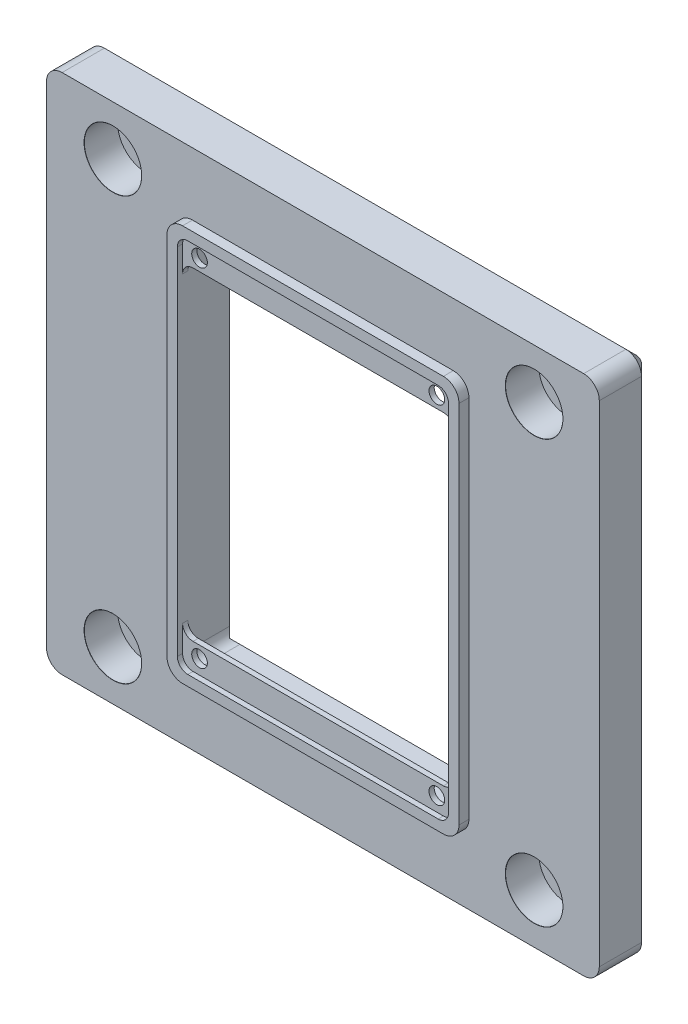
from build123d import *

# Parameters (mm, degrees)
BOSS_EXTRUDE3_DEPTH                          = 10
BOSS_EXTRUDE3_DEPTH_BACK                     = 0.1
SKETCH1_W                                    = 100
SKETCH1_H                                    = 106
SKETCH1_W_2                                  = 76
SKETCH1_H_2                                  = 56
CBORE_FOR_M6_HEX_SOCKET_HEAD_CAP_SCR_2_COUNT = 2
CBORE_FOR_M6_HEX_SOCKET_HEAD_CAP_SCR_2_PITCH = 81
CBORE_FOR_M6_HEX_SOCKET_HEAD_CAP_SCR_3_COUNT = 2
CBORE_FOR_M6_HEX_SOCKET_HEAD_CAP_SCR_3_PITCH = 114.385386776
CBORE_FOR_M6_HEX_SOCKET_HEAD_CAP_SCR_4_COUNT = 2
CBORE_FOR_M6_HEX_SOCKET_HEAD_CAP_SCR_4_PITCH = 80.765194904
SKETCH7_W                                    = 56
SKETCH7_H                                    = 76
BOSS_EXTRUDE4_DEPTH                          = 12
SKETCH8_W                                    = 52
SKETCH8_H                                    = 72
BOSS_EXTRUDE5_DEPTH                          = 1
SKETCH9_W                                    = 52
SKETCH9_H                                    = 72
CUT_EXTRUDE1_DEPTH                           = 1
SKETCH10_W                                   = 52
SKETCH10_H                                   = 62.005454301
CUT_EXTRUDE2_DEPTH                           = 11
SKETCH11_W                                   = 52
SKETCH11_H                                   = 4.999168043
SKETCH11_H_2                                 = 4.995377656
CUT_EXTRUDE3_DEPTH                           = 10
SKETCH12_R                                   = 1.5
CUT_EXTRUDE4_DEPTH                           = 2
SKETCH12_3_R                                 = 1.5
CUT_EXTRUDE5_DEPTH                           = 2
SKETCH14_R                                   = 1.5
CUT_EXTRUDE6_DEPTH                           = 2
SKETCH15_R                                   = 1.5
CUT_EXTRUDE7_DEPTH                           = 2
FILLET2_R                                    = 3
CHAMFER1_SIZE                                = 2
FILLET3_R                                    = 2
FILLET4_R                                    = 2


with BuildPart() as part:
    # Sketch1 → Boss-Extrude3 (new, two sides: drawn at the far end of the back side and taken through both)
    with BuildSketch(Plane(origin=(0, 0, 0), x_dir=(0, 1, 0), z_dir=(0, 0, 1)).offset(-BOSS_EXTRUDE3_DEPTH_BACK)):
        with Locations((-4.589836902, -8.848323211)):
            Rectangle(SKETCH1_W, SKETCH1_H)
        with Locations((-4.589836902, -8.848323211)):
            Rectangle(SKETCH1_W_2, SKETCH1_H_2, mode=Mode.SUBTRACT)
    extrude(amount=BOSS_EXTRUDE3_DEPTH + BOSS_EXTRUDE3_DEPTH_BACK)

    # Sketch6 → CBORE for M6 Hex Socket Head Cap Screw2 (revolve, cut)
    with BuildSketch(Plane(origin=(49.348323211, -45.089836902, 10), x_dir=(0, -1, 0), z_dir=(1, 0, 0))):
        Polygon((0, 0), (0, 10.1), (3.3, 10.1), (3.3, 6.4), (5.5, 6.4), (5.5, 0.025), (5.525, 0), align=None)
    cbore_for_m6_hex_socket_head_cap_screw2 = revolve(axis=Axis((49.348323211, -45.089836902, 16.35), (0, 0, -1)), mode=Mode.SUBTRACT)

    # CBORE for M6 Hex Socket Head Cap Scr 2: CBORE for M6 Hex Socket Head Cap Screw2 ×2
    with Locations(*[(0, i * CBORE_FOR_M6_HEX_SOCKET_HEAD_CAP_SCR_2_PITCH, 0) for i in range(1, CBORE_FOR_M6_HEX_SOCKET_HEAD_CAP_SCR_2_COUNT)]):
        add(cbore_for_m6_hex_socket_head_cap_screw2, mode=Mode.SUBTRACT)

    # CBORE for M6 Hex Socket Head Cap Scr 3: CBORE for M6 Hex Socket Head Cap Screw2 ×2
    with Locations(*[Vector(-0.7060796591298035, 0.7081324134391396, 0) * (i * CBORE_FOR_M6_HEX_SOCKET_HEAD_CAP_SCR_3_PITCH) for i in range(1, CBORE_FOR_M6_HEX_SOCKET_HEAD_CAP_SCR_3_COUNT)]):
        add(cbore_for_m6_hex_socket_head_cap_screw2, mode=Mode.SUBTRACT)

    # CBORE for M6 Hex Socket Head Cap Scr 4: CBORE for M6 Hex Socket Head Cap Screw2 ×2
    with Locations(*[(-i * CBORE_FOR_M6_HEX_SOCKET_HEAD_CAP_SCR_4_PITCH, 0, 0) for i in range(1, CBORE_FOR_M6_HEX_SOCKET_HEAD_CAP_SCR_4_COUNT)]):
        add(cbore_for_m6_hex_socket_head_cap_screw2, mode=Mode.SUBTRACT)

    # Sketch7 → Boss-Extrude4 (add)
    with BuildSketch(Plane(origin=(0, 0, -0.1), x_dir=(1, 0, 0), z_dir=(0, 0, -1))):
        with Locations((8.848323211, 4.589836902)):
            Rectangle(SKETCH7_W, SKETCH7_H)
    extrude(amount=-BOSS_EXTRUDE4_DEPTH)

    # Sketch8 → Boss-Extrude5 (add)
    with BuildSketch(Plane.XY.offset(11.9)):
        with Locations((8.848323211, -4.589836902)):
            Rectangle(SKETCH8_W, SKETCH8_H)
    extrude(amount=-BOSS_EXTRUDE5_DEPTH)

    # Sketch9 → Cut-Extrude1 (cut)
    with BuildSketch(Plane.XY.offset(11.9)):
        with Locations((8.848323211, -4.589836902)):
            Rectangle(SKETCH9_W, SKETCH9_H)
    extrude(amount=-CUT_EXTRUDE1_DEPTH, mode=Mode.SUBTRACT)

    # Sketch10 → Cut-Extrude2 (cut)
    with BuildSketch(Plane.XY.offset(10.9)):
        with Locations((8.848323211, -4.587941709)):
            Rectangle(SKETCH10_W, SKETCH10_H)
    extrude(amount=-CUT_EXTRUDE2_DEPTH, mode=Mode.SUBTRACT)

    # Sketch11 → Cut-Extrude3 (cut)
    with BuildSketch(Plane(origin=(0, 0, -0.1), x_dir=(1, 0, 0), z_dir=(0, 0, -1))):
        with Locations((8.848323211, 38.090252881)):
            Rectangle(SKETCH11_W, SKETCH11_H)
        with Locations((8.848323211, -28.91247427)):
            Rectangle(SKETCH11_W, SKETCH11_H_2)
    extrude(amount=-CUT_EXTRUDE3_DEPTH, mode=Mode.SUBTRACT)

    # Sketch12 → Cut-Extrude4 (cut)
    with BuildSketch(Plane.XY.offset(10.9)):
        with Locations((-13.901676789, 28.660163098)):
            Circle(SKETCH12_R)
    extrude(amount=-CUT_EXTRUDE4_DEPTH, mode=Mode.SUBTRACT)

    # Sketch12<3> → Cut-Extrude5 (cut)
    with BuildSketch(Plane.XY.offset(10.9)):
        with Locations((31.598323211, 28.660163098)):
            Circle(SKETCH12_3_R)
    extrude(amount=-CUT_EXTRUDE5_DEPTH, mode=Mode.SUBTRACT)

    # Sketch14 → Cut-Extrude6 (cut)
    with BuildSketch(Plane.XY.offset(10.9)):
        with Locations((-13.901676789, -37.839836902)):
            Circle(SKETCH14_R)
    extrude(amount=-CUT_EXTRUDE6_DEPTH, mode=Mode.SUBTRACT)

    # Sketch15 → Cut-Extrude7 (cut)
    with BuildSketch(Plane.XY.offset(10.9)):
        with Locations((31.598323211, -37.839836902)):
            Circle(SKETCH15_R)
    extrude(amount=-CUT_EXTRUDE7_DEPTH, mode=Mode.SUBTRACT)

    # Fillet2
    fillet2_edges = [part.edges().sort_by_distance(p)[0] for p in [
        (-44.151676789, 45.410163098, 4.95),
        (-19.151676789, 33.410163098, 10.95),
        (36.848323211, 33.410163098, 10.95),
        (61.848323211, 45.410163098, 4.95),
        (36.848323211, -42.589836902, 10.95),
        (61.848323211, -54.589836902, 4.95),
        (-44.151676789, -54.589836902, 4.95),
        (-19.151676789, -42.589836902, 10.95),
    ]]
    fillet(fillet2_edges, radius=FILLET2_R)

    # Chamfer1
    chamfer1_edges = [part.edges().sort_by_distance(p)[0] for p in [
        (8.848323211, 31.410163098, -0.1),
        (34.848323211, -4.589836902, -0.1),
        (8.848323211, -40.589836902, -0.1),
        (-17.151676789, -4.589836902, -0.1),
        (49.348323211, 39.210163098, -0.1),
        (-31.416871693, 39.210163098, -0.1),
        (-31.416871693, -41.789836902, -0.1),
        (49.348323211, -41.789836902, -0.1),
        (-43.272997132, -53.711157246, -0.1),
        (8.848323211, -54.589836902, -0.1),
        (60.969643555, -53.711157246, -0.1),
        (61.848323211, -4.589836902, -0.1),
        (60.969643555, 44.531483441, -0.1),
        (8.848323211, 45.410163098, -0.1),
        (-43.272997132, 44.531483441, -0.1),
        (-44.151676789, -4.589836902, -0.1),
    ]]
    chamfer(chamfer1_edges, length=CHAMFER1_SIZE)

    # Fillet3
    fillet3_edges = [part.edges().sort_by_distance(p)[0] for p in [
        (34.848323211, -35.590668859, 10.4),
    ]]
    fillet(fillet3_edges, radius=FILLET3_R)

    # Fillet4
    fillet4_edges = [part.edges().sort_by_distance(p)[0] for p in [
        (-17.151676789, 26.414785442, 10.4),
        (-17.151676789, 31.410163098, 5.9),
        (-17.151676789, 31.410163098, 11.4),
        (34.848323211, 31.410163098, 5.9),
        (34.848323211, 26.414785442, 10.4),
        (34.848323211, 31.410163098, 11.4),
        (-17.151676789, -40.589836902, 5.9),
        (-17.151676789, -40.589836902, 11.4),
        (-17.151676789, -35.590668859, 10.4),
        (34.848323211, -40.589836902, 5.9),
        (34.848323211, -40.589836902, 11.4),
    ]]
    fillet(fillet4_edges, radius=FILLET4_R)


solid = part.part
